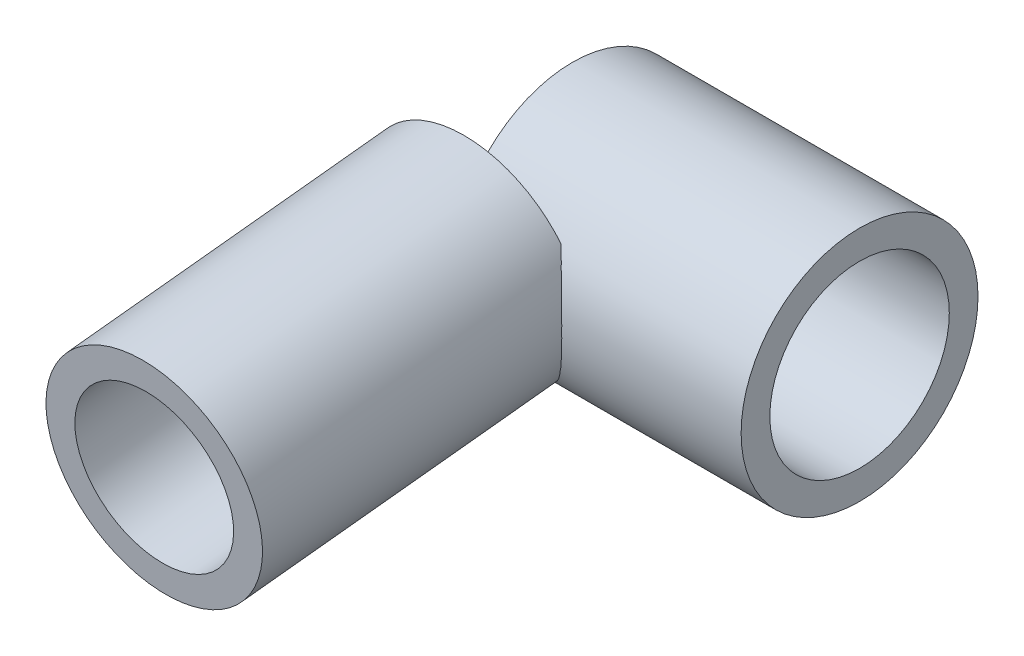
from build123d import *

# Parameters (mm, degrees)
SKETCH4_W = 4
SKETCH4_H = 45
SKETCH5_W = 40
SKETCH5_H = 4


with BuildPart() as part:
    # Sketch4 → Revolve1 (revolve)
    with BuildSketch(Plane(origin=(0, 0, 0), x_dir=(1, 0, 0), z_dir=(0, 0.9943889131791124, 0.10578605459352264)), mode=Mode.PRIVATE) as revolve1_sk:
        with Locations((13, -19.5)):
            Rectangle(SKETCH4_W, SKETCH4_H)
    revolve(revolve1_sk.sketch.rotate(Axis((0, 0, 0), (0, -0.10578605459352264, 0.9943889131791124)), 90), axis=Axis((0, 0, 0), (0, -0.10578605459352264, 0.9943889131791124)))


with BuildPart() as body_2:
    # Sketch5 → Revolve2 (revolve)
    with BuildSketch(Plane(origin=(0, 0, 0), x_dir=(1, 0, 0), z_dir=(0, 1, 0))):
        with Locations((20, 2)):
            Rectangle(SKETCH5_W, SKETCH5_H)
    revolve(axis=Axis((0, 0, -16.5), (1, 0, 0)))


solid = Compound([part.part, body_2.part])
